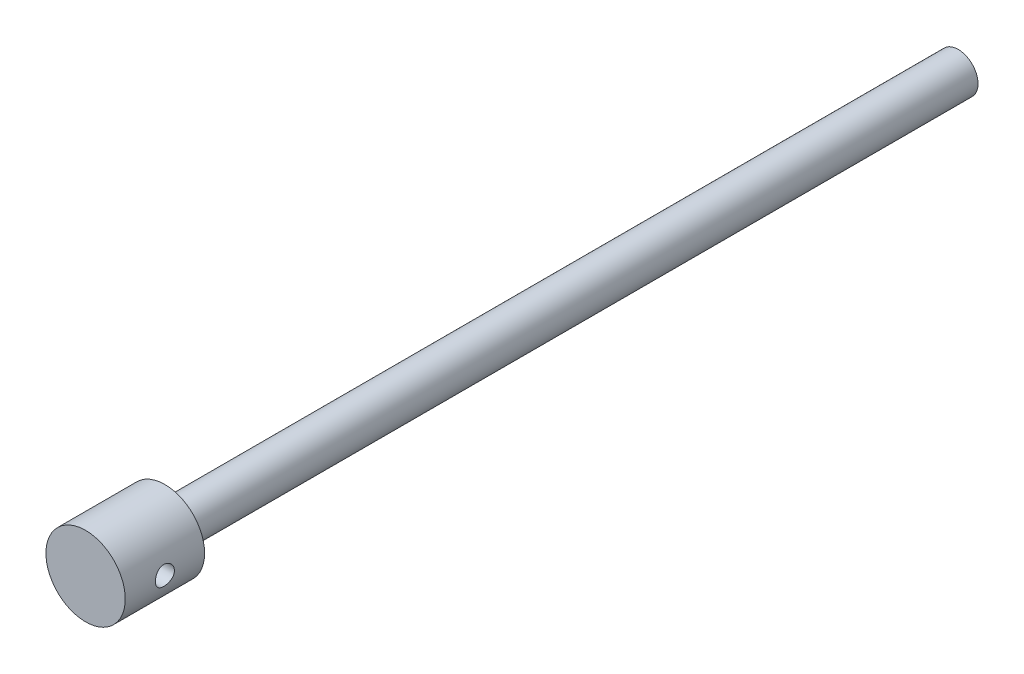
from build123d import *

# Parameters (mm, degrees)
SKETCH1_R           = 25
BOSS_EXTRUDE1_DEPTH = 25
SKETCH2_R           = 6
CUT_EXTRUDE1_DEPTH  = 35
SKETCH3_R           = 12.5
BOSS_EXTRUDE2_DEPTH = 500


with BuildPart() as part:
    # Sketch1 → Boss-Extrude1 (new, symmetric)
    with BuildSketch(Plane.XY):
        Circle(SKETCH1_R)
    extrude(amount=BOSS_EXTRUDE1_DEPTH, both=True)

    # Sketch2 → Cut-Extrude1 (cut, symmetric)
    with BuildSketch(Plane(origin=(0, 0, 0), x_dir=(0, 0, -1), z_dir=(1, 0, 0))):
        with Locations(Location((0, 0, 0), (0, 0, 180))):
            Circle(SKETCH2_R)
    extrude(amount=CUT_EXTRUDE1_DEPTH, both=True, mode=Mode.SUBTRACT)

    # Sketch3 → Boss-Extrude2 (add)
    with BuildSketch(Plane(origin=(0, 0, -25), x_dir=(-1, 0, 0), z_dir=(0, 0, -1))):
        Circle(SKETCH3_R)
    extrude(amount=BOSS_EXTRUDE2_DEPTH)


solid = part.part
